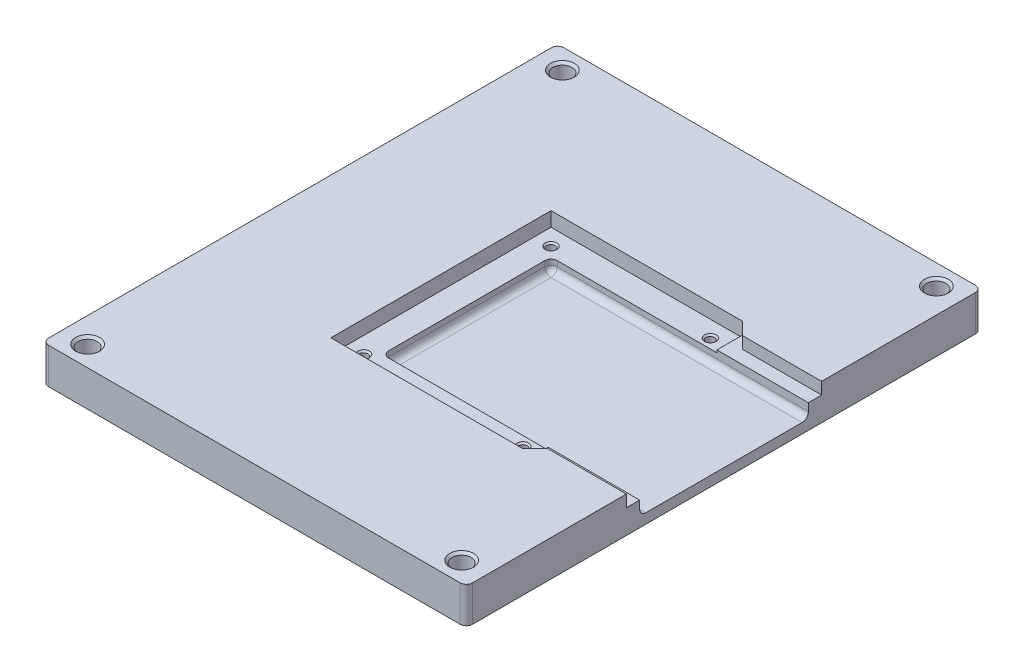
from build123d import *

# Parameters (mm, degrees)
BOSS_EXTRUDE1_DEPTH     = 11.5
SKETCH4_R               = 3.075
CUT_EXTRUDE1_DEPTH      = 6
CUT_EXTRUDE6_DEPTH      = 4.6
CUT_EXTRUDE3_DEPTH      = 108.055479192
CUT_EXTRUDE3_DEPTH_BACK = 3.7
SKETCH24_W              = 82.375
SKETCH24_H              = 54
SKETCH25_R              = 1.35
CUT_EXTRUDE4_DEPTH      = 5
CHAMFER4_SIZE           = 0.5
FILLET1_R               = 2
BOSS_EXTRUDE2_DEPTH     = 0.8
CHAMFER5_SIZE           = 0.75


with BuildPart() as part:
    # Sketch1 → Boss-Extrude1 (new body)
    with BuildSketch(Plane(origin=(0, 0, 0), x_dir=(1, 0, 0), z_dir=(0, 1, 0))):
        with BuildLine():
            Line((-67.875, 67.5), (-67.875, -67.5))
            Line((-67.875, -67.5), (-67.875, -80.5))
            ThreePointArc((-67.875, -80.5), (-67.289213562, -81.914213562), (-65.875, -82.5))
            Line((-65.875, -82.5), (65.875, -82.5))
            ThreePointArc((65.875, -82.5), (67.289213562, -81.914213562), (67.875, -80.5))
            Line((67.875, -80.5), (67.875, -67.5))
            Line((67.875, -67.5), (67.875, 67.5))
            Line((67.875, 67.5), (67.875, 80.5))
            ThreePointArc((67.875, 80.5), (67.289213562, 81.914213562), (65.875, 82.5))
            Line((65.875, 82.5), (-65.875, 82.5))
            ThreePointArc((-65.875, 82.5), (-67.289213562, 81.914213562), (-67.875, 80.5))
            Line((-67.875, 80.5), (-67.875, 67.5))
        make_face()
    extrude(amount=BOSS_EXTRUDE1_DEPTH)

    # Sketch4 → Cut-Extrude1 (cut)
    with BuildSketch(Plane(origin=(0, 11.5, 0), x_dir=(1, 0, 0), z_dir=(0, 1, 0))):
        with Locations(Location((-59.875, -76, 0), (0, 0, 270))):
            Circle(SKETCH4_R)
        with Locations(Location((59.875, -76, 0), (0, 0, 270))):
            Circle(SKETCH4_R)
        with Locations(Location((59.875, 76, 0), (0, 0, 270))):
            Circle(SKETCH4_R)
        with Locations(Location((-59.875, 76, 0), (0, 0, 270))):
            Circle(SKETCH4_R)
    extrude(amount=-CUT_EXTRUDE1_DEPTH, mode=Mode.SUBTRACT)

    # Sketch21 → Cut-Extrude6 (cut)
    with BuildSketch(Plane(origin=(0, 11.5, 0), x_dir=(1, 0, 0), z_dir=(0, 1, 0))):
        Polygon((67.875, 31), (67.875, -31), (67.875, -31.25), (42.603553391, -31.25), (38.603553391, -35.25), (-22.75, -35.25), (-22.75, 35.25), (38.603553391, 35.25), (42.603553391, 31.25), (67.875, 31.25), align=None)
    extrude(amount=-CUT_EXTRUDE6_DEPTH, mode=Mode.SUBTRACT)

    # Sketch24 → Cut-Extrude3 (cut, two sides: drawn at the far end of the back side and taken through both)
    with BuildSketch(Plane(origin=(0, 6.9, 0), x_dir=(1, 0, 0), z_dir=(0, 1, 0)).offset(-CUT_EXTRUDE3_DEPTH_BACK)):
        with Locations((26.6875, 0)):
            Rectangle(SKETCH24_W, SKETCH24_H)
    extrude(amount=CUT_EXTRUDE3_DEPTH + CUT_EXTRUDE3_DEPTH_BACK, mode=Mode.SUBTRACT)

    # Sketch25 → Cut-Extrude4 (cut)
    with BuildSketch(Plane(origin=(0, 6.9, 0), x_dir=(1, 0, 0), z_dir=(0, 1, 0))):
        with Locations(Location((33.5, 30, 0), (0, 0, 270))):
            Circle(SKETCH25_R)
        with Locations(Location((-17.5, 30, 0), (0, 0, 270))):
            Circle(SKETCH25_R)
        with Locations(Location((33.5, -30, 0), (0, 0, 270))):
            Circle(SKETCH25_R)
        with Locations(Location((-17.5, -30, 0), (0, 0, 270))):
            Circle(SKETCH25_R)
    extrude(amount=-CUT_EXTRUDE4_DEPTH, mode=Mode.SUBTRACT)

    # Chamfer4
    chamfer4_edges = [part.edges().sort_by_distance(p)[0] for p in [
        (-17.5, 6.9, -31.35),
        (33.5, 6.9, 28.65),
        (-17.5, 6.9, 28.65),
        (33.5, 6.9, -31.35),
    ]]
    chamfer(chamfer4_edges, length=CHAMFER4_SIZE)

    # Fillet1
    fillet1_edges = [part.edges().sort_by_distance(p)[0] for p in [
        (26.6875, 3.2, -27),
        (-14.5, 5.05, -27),
        (-14.5, 3.2, 0),
        (-14.5, 5.05, 27),
        (26.6875, 3.2, 27),
    ]]
    fillet(fillet1_edges, radius=FILLET1_R)

    # Sketch26 → Boss-Extrude2 (add)
    with BuildSketch(Plane(origin=(0, 6.9, 0), x_dir=(1, 0, 0), z_dir=(0, 1, 0))):
        Polygon((38.603553391, 35.25), (38.603553391, 27), (67.875, 27), (67.875, 31.25), (42.603553391, 31.25), align=None)
        Polygon((42.603553391, -31.25), (38.603553391, -35.25), (38.603553391, -27), (67.875, -27), (67.875, -31.25), align=None)
    extrude(amount=BOSS_EXTRUDE2_DEPTH)

    # Chamfer5
    chamfer5_edges = [part.edges().sort_by_distance(p)[0] for p in [
        (-59.875, 11.5, -79.075),
        (59.875, 11.5, -79.075),
        (59.875, 11.5, 72.925),
        (-59.875, 11.5, 72.925),
    ]]
    chamfer(chamfer5_edges, length=CHAMFER5_SIZE)


solid = part.part
